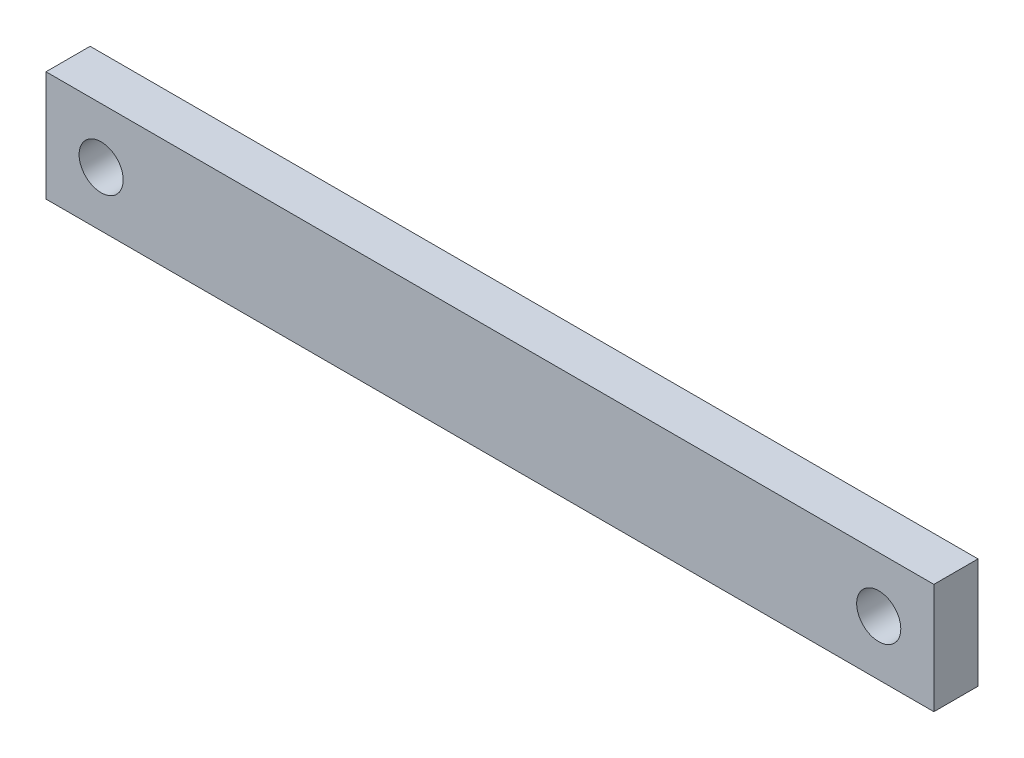
from build123d import *

# Parameters (mm, degrees)
SKETCH1_W           = 161
SKETCH1_H           = 20
SKETCH1_R           = 4
BOSS_EXTRUDE1_DEPTH = 8


with BuildPart() as part:
    # Sketch1 → Boss-Extrude1 (new body)
    with BuildSketch(Plane.XY):
        Rectangle(SKETCH1_W, SKETCH1_H)
        with Locations((-70.5, 0)):
            Circle(SKETCH1_R, mode=Mode.SUBTRACT)
        with Locations((70.5, 0)):
            Circle(SKETCH1_R, mode=Mode.SUBTRACT)
    extrude(amount=BOSS_EXTRUDE1_DEPTH)


solid = part.part
